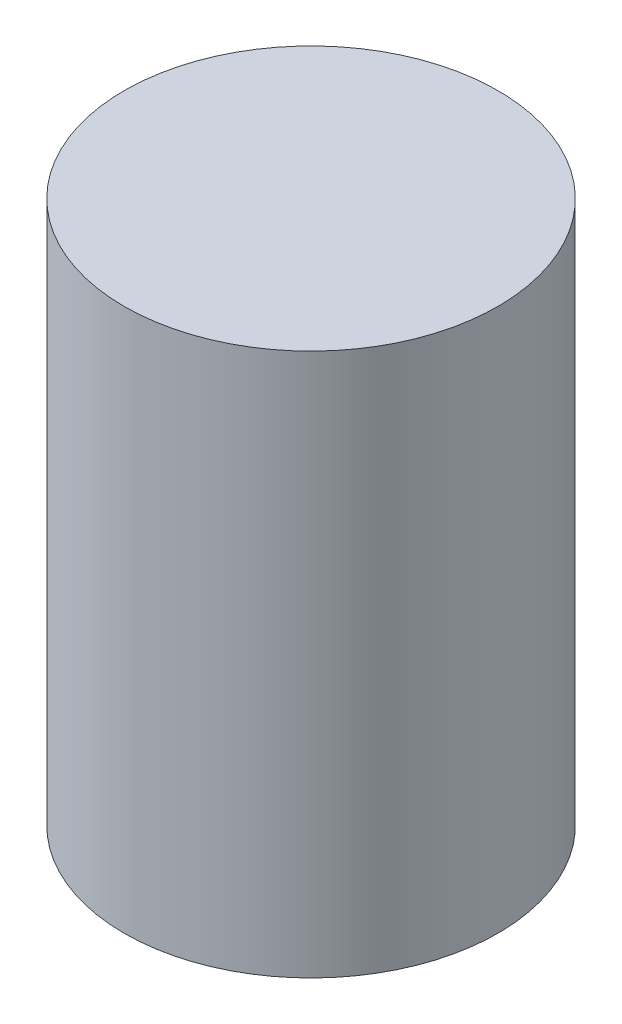
from build123d import *

# Parameters (mm, degrees)
SKETCH1_R           = 5
BOSS_EXTRUDE1_DEPTH = 7.262


with BuildPart() as part:
    # Sketch1 → Boss-Extrude1 (new, symmetric)
    with BuildSketch(Plane(origin=(0, 0, 0), x_dir=(1, 0, 0), z_dir=(0, 1, 0))):
        with Locations(Location((0, 0, 0), (0, 0, 270))):
            Circle(SKETCH1_R)
    extrude(amount=BOSS_EXTRUDE1_DEPTH, both=True)


solid = part.part
